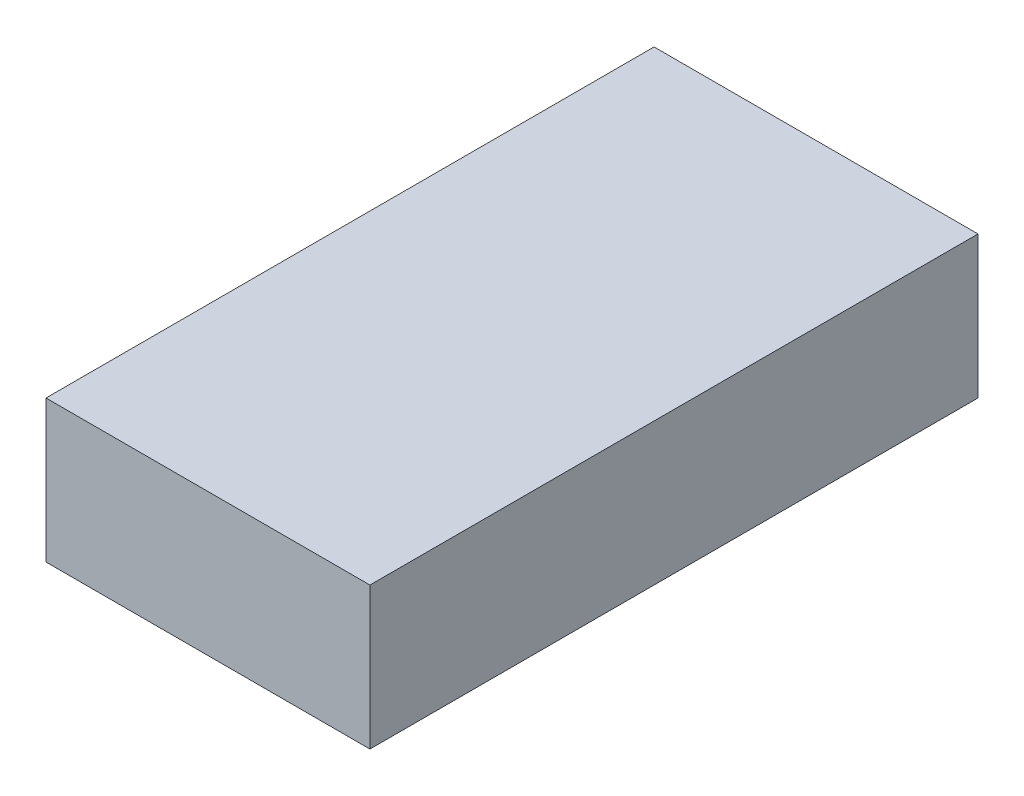
from build123d import *

# Parameters (mm, degrees)
SKETCH1_W           = 114
SKETCH1_H           = 50
BOSS_EXTRUDE1_DEPTH = 214


with BuildPart() as part:
    # Sketch1 → Boss-Extrude1 (new body)
    with BuildSketch(Plane.XY):
        Rectangle(SKETCH1_W, SKETCH1_H)
    extrude(amount=BOSS_EXTRUDE1_DEPTH)


solid = part.part
